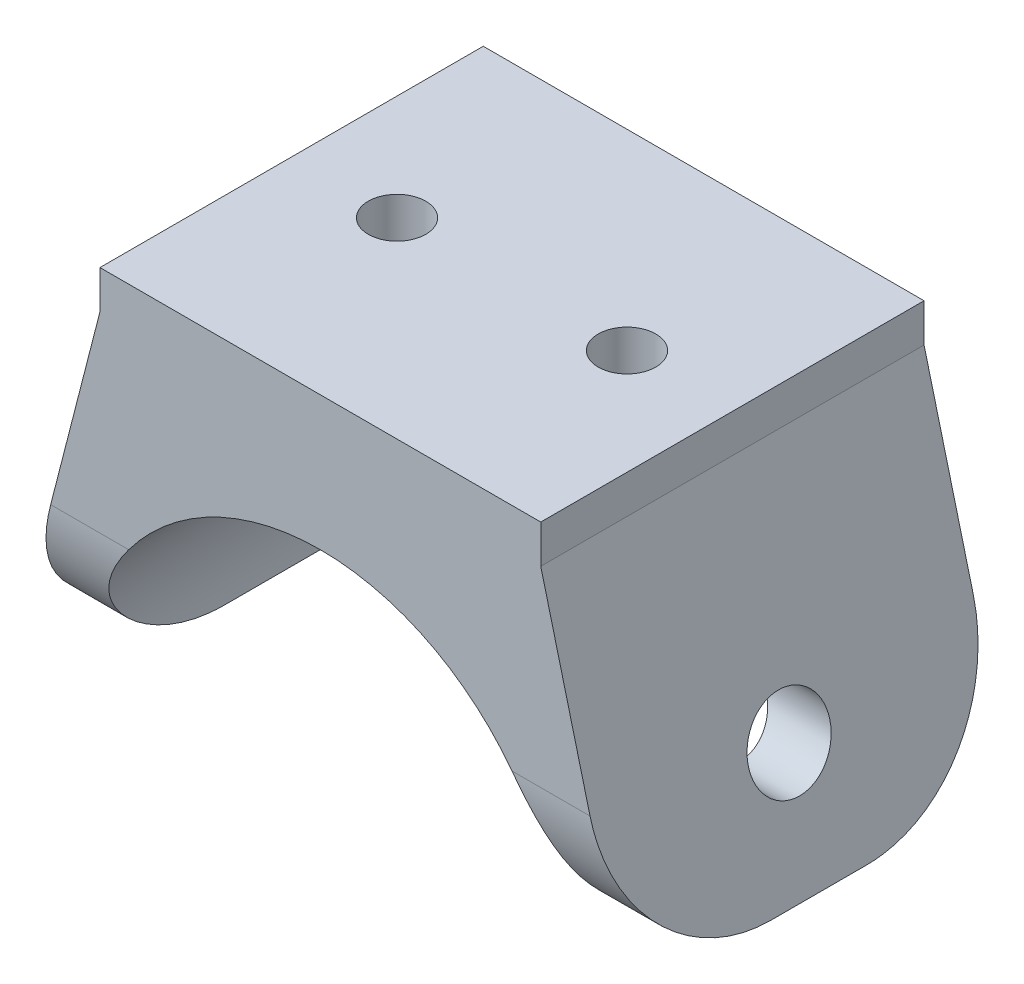
from build123d import *

# Parameters (mm, degrees)
SKETCH1_W               = 64
SKETCH1_H               = 39
BOSS_EXTRUDE1_DEPTH     = 20
CUT_EXTRUDE1_DEPTH      = 58.905094767
CUT_EXTRUDE2_DEPTH      = 58.905094767
FILLET1_R               = 15
SKETCH4_R               = 3
CUT_EXTRUDE3_DEPTH      = 14
FILLET1_OF_MIRROR1_R    = 15
CUT_EXTRUDE4_DEPTH      = 47.400431145
CUT_EXTRUDE4_DEPTH_BACK = 47.400431145
SKETCH5_R               = 4.25


with BuildPart() as part:
    # Sketch1 → Boss-Extrude1 (new, symmetric)
    with BuildSketch(Plane.XY):
        with Locations((0, 7.5)):
            Rectangle(SKETCH1_W, SKETCH1_H)
    extrude(amount=BOSS_EXTRUDE1_DEPTH, both=True)

    # Sketch2 → Cut-Extrude1 (cut, through all)
    with BuildSketch(Plane.XY.offset(20)):
        with BuildLine():
            Line((-25, -12), (25, -12))
            ThreePointArc((25, -12), (0, 13), (-25, -12))
        make_face()
    extrude(amount=-CUT_EXTRUDE1_DEPTH, mode=Mode.SUBTRACT)

    # Sketch3 → Cut-Extrude2 (cut, through all)
    with BuildSketch(Plane.XY.offset(20)):
        Polygon((32, -12), (23, 23), (23, 27), (32, 27), align=None)
    cut_extrude2 = extrude(amount=-CUT_EXTRUDE2_DEPTH, mode=Mode.SUBTRACT)

    # Fillet1
    fillet1_edges = [part.edges().sort_by_distance(p)[0] for p in [
        (28.5, -12, -20),
        (28.5, -12, 20),
    ]]
    fillet(fillet1_edges, radius=FILLET1_R)

    # Sketch4 → Cut-Extrude3 (cut)
    with BuildSketch(Plane(origin=(0, 27, 0), x_dir=(1, 0, 0), z_dir=(0, 1, 0))):
        with Locations(Location((12, 0, 0), (0, 0, 270))):
            Circle(SKETCH4_R)
    cut_extrude3 = extrude(amount=-CUT_EXTRUDE3_DEPTH, mode=Mode.SUBTRACT)

    # Mirror1: Cut-Extrude2, Cut-Extrude3 across plane
    add(cut_extrude2.mirror(Plane(origin=(0, 0, 0), x_dir=(0, 0, 1), z_dir=(1, 0, 0))), mode=Mode.SUBTRACT)
    add(cut_extrude3.mirror(Plane(origin=(0, 0, 0), x_dir=(0, 0, 1), z_dir=(1, 0, 0))), mode=Mode.SUBTRACT)

    # Fillet1 of Mirror1
    fillet1_of_mirror1_edges = [part.edges().sort_by_distance(p)[0] for p in [
        (-28.5, -12, -20),
        (-28.5, -12, 20),
    ]]
    fillet(fillet1_of_mirror1_edges, radius=FILLET1_OF_MIRROR1_R)

    # Sketch5 → Cut-Extrude4 (cut, two sides: drawn at the far end of the back side and taken through both)
    with BuildSketch(Plane(origin=(0, 0, 0), x_dir=(0, 0, -1), z_dir=(1, 0, 0)).offset(-CUT_EXTRUDE4_DEPTH_BACK)):
        Circle(SKETCH5_R)
    extrude(amount=CUT_EXTRUDE4_DEPTH + CUT_EXTRUDE4_DEPTH_BACK, mode=Mode.SUBTRACT)


solid = part.part
